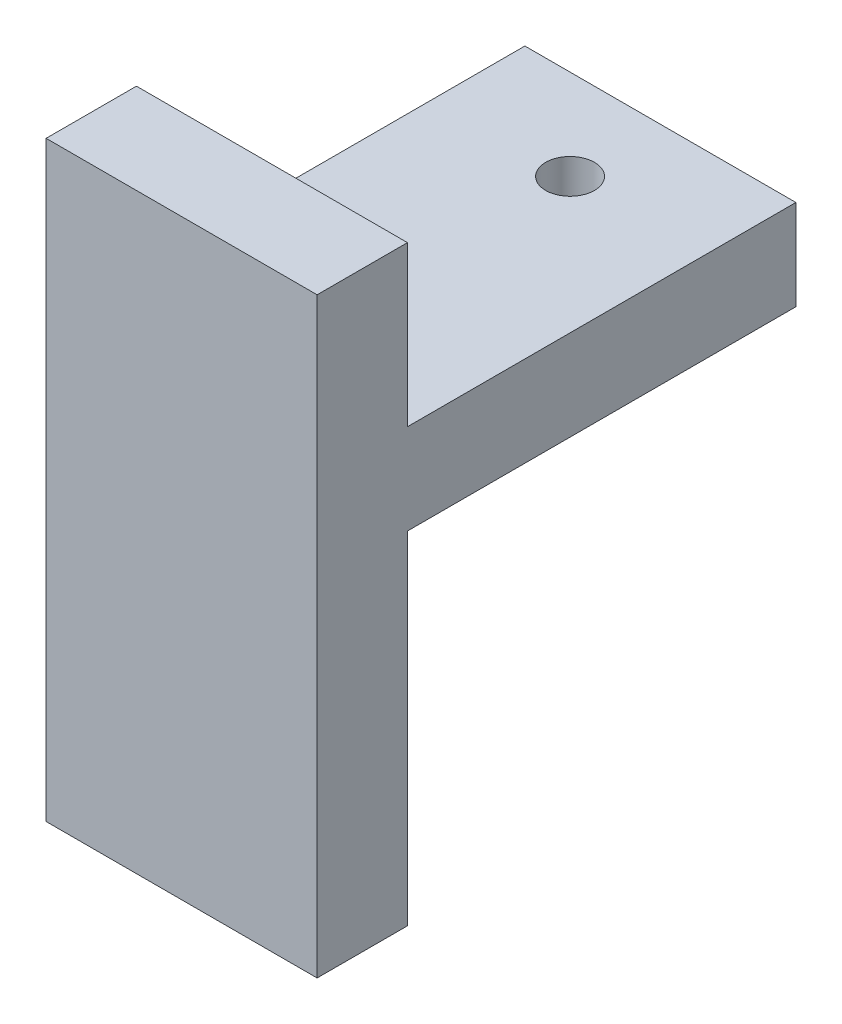
from build123d import *

# Parameters (mm, degrees)
SKETCH1_W           = 30
SKETCH1_H           = 53
SKETCH1_R           = 2.7
BOSS_EXTRUDE1_DEPTH = 10
SKETCH3_W           = 30
SKETCH3_H           = 10
BOSS_EXTRUDE2_DEPTH = 17.65
SKETCH5_W           = 30
SKETCH5_H           = 10
BOSS_EXTRUDE4_DEPTH = 37.85


with BuildPart() as part:
    # Sketch1 → Boss-Extrude1 (new body)
    with BuildSketch(Plane(origin=(0, 0, 0), x_dir=(1, 0, 0), z_dir=(0, 1, 0))):
        Rectangle(SKETCH1_W, SKETCH1_H)
        with Locations(Location((0, 16.5, 0), (0, 0, 270))):
            Circle(SKETCH1_R, mode=Mode.SUBTRACT)
    extrude(amount=BOSS_EXTRUDE1_DEPTH)

    # Sketch3 → Boss-Extrude2 (add)
    with BuildSketch(Plane(origin=(0, 10, 0), x_dir=(1, 0, 0), z_dir=(0, 1, 0))):
        with Locations((0, -21.5)):
            Rectangle(SKETCH3_W, SKETCH3_H)
    extrude(amount=BOSS_EXTRUDE2_DEPTH)

    # Sketch5 → Boss-Extrude4 (add)
    with BuildSketch(Plane.XZ):
        with Locations((0, 21.5)):
            Rectangle(SKETCH5_W, SKETCH5_H)
    extrude(amount=BOSS_EXTRUDE4_DEPTH)


solid = part.part
